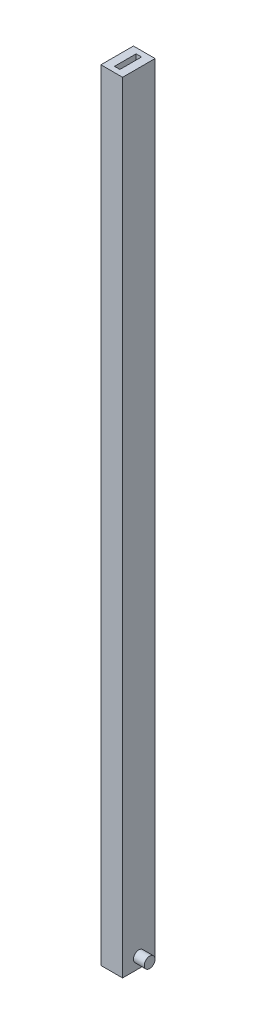
from build123d import *

# Parameters (mm, degrees)
SKETCH1_W           = 12.7
SKETCH1_H           = 19.05
SKETCH1_W_2         = 3.175
SKETCH1_H_2         = 12.7
BOSS_EXTRUDE1_DEPTH = 457.2
BOSS_EXTRUDE2_REACH = 459.368
SKETCH2_R           = 3.175
SKETCH3_R           = 3.175
BOSS_EXTRUDE3_DEPTH = 6.35
BOSS_EXTRUDE4_START = 6.35
SKETCH4_R           = 3.175
BOSS_EXTRUDE4_DEPTH = 6.35


with BuildPart() as part:
    # Sketch1 → Boss-Extrude1 (new body)
    with BuildSketch(Plane(origin=(0, 0, 0), x_dir=(1, 0, 0), z_dir=(0, 1, 0))):
        Rectangle(SKETCH1_W, SKETCH1_H)
        Rectangle(SKETCH1_W_2, SKETCH1_H_2, mode=Mode.SUBTRACT)
    extrude(amount=BOSS_EXTRUDE1_DEPTH)

    # Sketch2 → Boss-Extrude2 (add, up to next)
    with BuildSketch(Plane(origin=(-1.5875, 0, 0), x_dir=(0, 0, -1), z_dir=(1, 0, 0)), mode=Mode.PRIVATE) as boss_extrude2_sk1:
        with Locations(Location((0, 450.85, 0), (0, 0, 180))):
            Circle(SKETCH2_R)
    boss_extrude2_tool1 = extrude(boss_extrude2_sk1.sketch, amount=BOSS_EXTRUDE2_REACH, mode=Mode.PRIVATE) - part.part
    add(boss_extrude2_tool1.solids().sort_by_distance((-1.5875, 450.85, 0))[0])

    # Sketch3 → Boss-Extrude3 (add)
    with BuildSketch(Plane(origin=(6.35, 0, 0), x_dir=(0, 0, -1), z_dir=(1, 0, 0))):
        with Locations(Location((0, 6.35, 0), (0, 0, 180))):
            Circle(SKETCH3_R)
    extrude(amount=BOSS_EXTRUDE3_DEPTH)

    # Sketch4 → Boss-Extrude4 (add)
    with BuildSketch(Plane.ZY.offset(6.35).offset(BOSS_EXTRUDE4_START)):
        with Locations((0, 6.35)):
            Circle(SKETCH4_R)
    extrude(amount=-BOSS_EXTRUDE4_DEPTH)


solid = part.part
